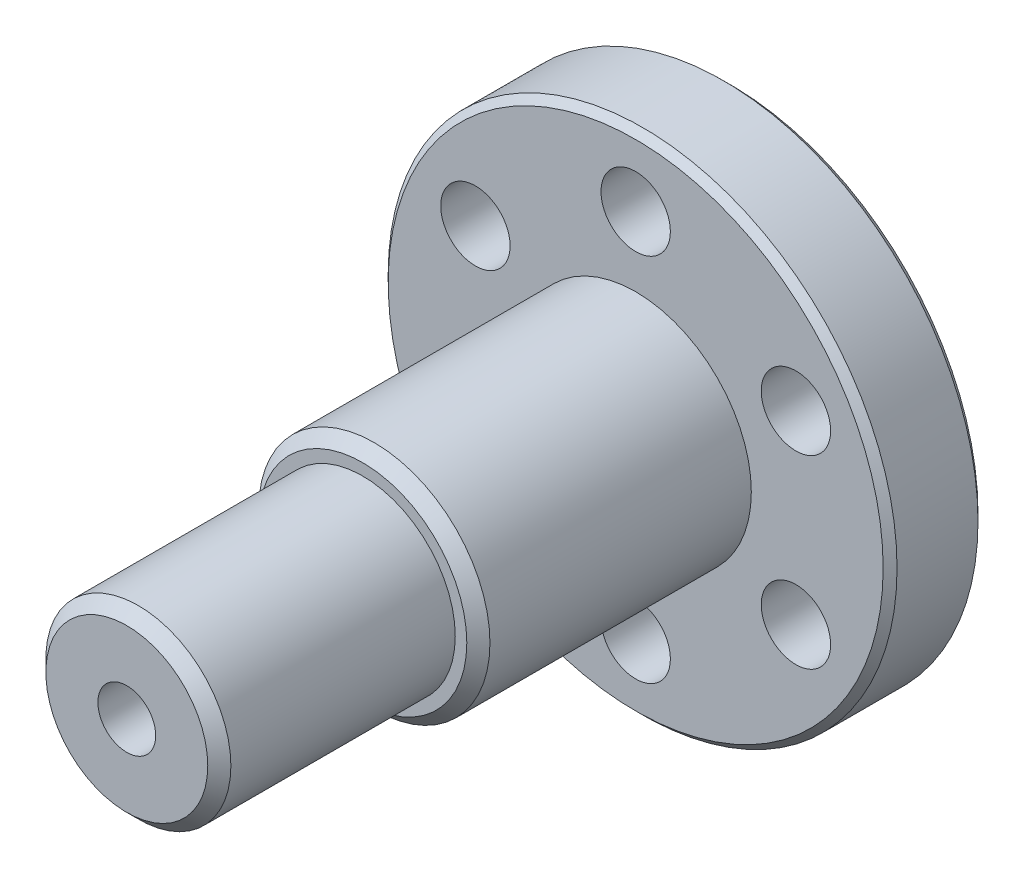
from build123d import *

# Parameters (mm, degrees)
SKETCH_1_R             = 11
SKETCH_1_R_2           = 1.5
EXTRUDE_1_DEPTH        = 4.1
SKETCH_2_R             = 5
EXTRUDE_2_DEPTH        = 22
SKETCH_3_OUTSIDE_W     = 32.122
SKETCH_3_OUTSIDE_H     = 32.122
SKETCH_3_OUTSIDE_R     = 4
CUT_EXTRUDE_1_DEPTH    = 10.2
CHAMFER_1_SIZE         = 0.5
HOLE_WIZARD_M3_1_D     = 2.5
HOLE_WIZARD_M3_1_DEPTH = 9.5
HOLE_WIZARD_M3_1_TIP   = 0.751075774
CHAMFER_2_SIZE         = 0.3


with BuildPart() as part:
    # 草图1 → 凸台-拉伸1 (new body)
    with BuildSketch(Plane.XY):
        Circle(SKETCH_1_R)
        with Locations((0, 8)):
            Circle(SKETCH_1_R_2, mode=Mode.SUBTRACT)
        with Locations((6.92820323, 4)):
            Circle(SKETCH_1_R_2, mode=Mode.SUBTRACT)
        with Locations((6.92820323, -4)):
            Circle(SKETCH_1_R_2, mode=Mode.SUBTRACT)
        with Locations((0, -8)):
            Circle(SKETCH_1_R_2, mode=Mode.SUBTRACT)
        with Locations((-6.92820323, -4)):
            Circle(SKETCH_1_R_2, mode=Mode.SUBTRACT)
        with Locations((-6.92820323, 4)):
            Circle(SKETCH_1_R_2, mode=Mode.SUBTRACT)
    extrude(amount=EXTRUDE_1_DEPTH)

    # 草图2 → 凸台-拉伸2 (add)
    with BuildSketch(Plane.XY.offset(4.1)):
        Circle(SKETCH_2_R)
    extrude(amount=EXTRUDE_2_DEPTH)

    # 草图3 outside → 切除-拉伸1 (cut)
    with BuildSketch(Plane.XY.offset(26.1)):
        Rectangle(SKETCH_3_OUTSIDE_W, SKETCH_3_OUTSIDE_H)
        Circle(SKETCH_3_OUTSIDE_R, mode=Mode.SUBTRACT)
    extrude(amount=-CUT_EXTRUDE_1_DEPTH, mode=Mode.SUBTRACT)

    # 倒角1
    chamfer_1_edges = [part.edges().sort_by_distance(p)[0] for p in [
        (-4, 0, 26.1),
        (-5, 0, 15.9),
    ]]
    chamfer(chamfer_1_edges, length=CHAMFER_1_SIZE)

    # M3 螺纹孔1
    with Locations(Plane.XY.offset(26.1)):
        with Locations((0, 0)):
            Hole(HOLE_WIZARD_M3_1_D / 2, depth=HOLE_WIZARD_M3_1_DEPTH)
            with Locations((0, 0, -(HOLE_WIZARD_M3_1_DEPTH + HOLE_WIZARD_M3_1_TIP / 2))):  # 118° drill point
                Cone(0, HOLE_WIZARD_M3_1_D / 2, HOLE_WIZARD_M3_1_TIP, mode=Mode.SUBTRACT)

    # 倒角2
    chamfer_2_edges = [part.edges().sort_by_distance(p)[0] for p in [
        (-11, 0, 0),
        (-11, 0, 4.1),
    ]]
    chamfer(chamfer_2_edges, length=CHAMFER_2_SIZE)


solid = part.part
